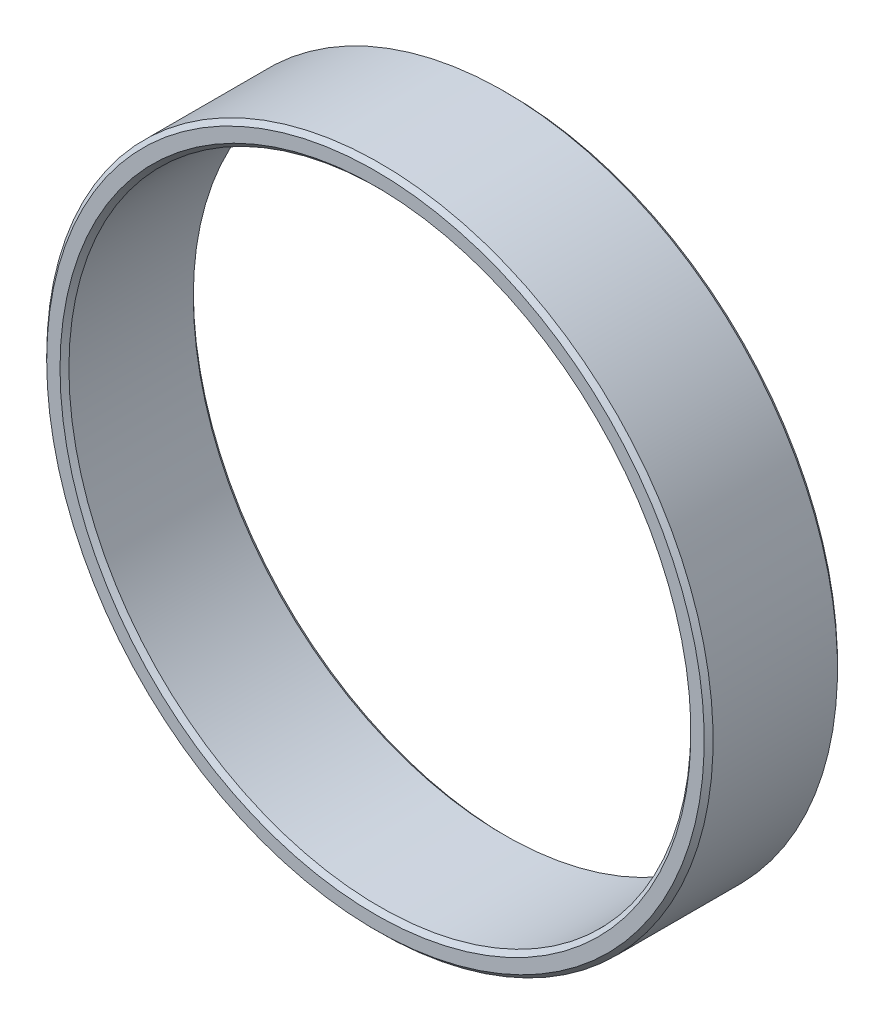
from build123d import *


with BuildPart() as part:
    # Sketch1 → Revolve1 (revolve)
    with BuildSketch(Plane(origin=(0, 0, 0), x_dir=(0, 0, -1), z_dir=(1, 0, 0)), mode=Mode.PRIVATE) as revolve1_sk:
        Polygon((-35.904448862, 37), (-35.404448862, 37.5), (-21.404448862, 37.5), (-20.904448862, 37), (-20.904448862, 35.5), (-21.404448862, 35), (-35.404448862, 35), (-35.904448862, 35.5), align=None)
    revolve(revolve1_sk.sketch.rotate(Axis((0, 0, 0), (0, 0, 1)), 90), axis=Axis((0, 0, 0), (0, 0, 1)))


solid = part.part
